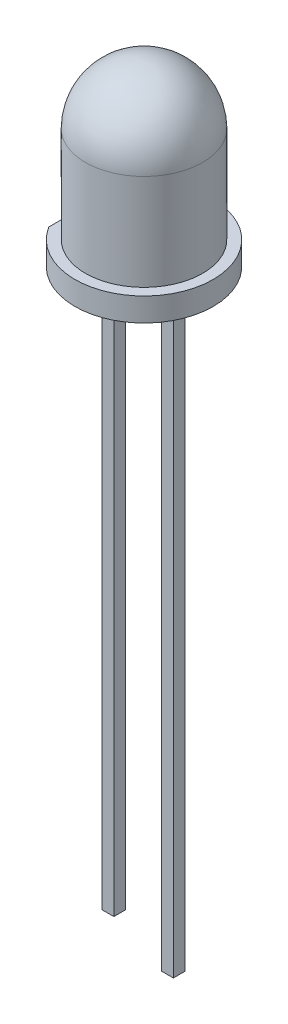
from build123d import *

# Parameters (mm, degrees)
CROQUIS3_W              = 0.5
CROQUIS3_H              = 0.5
SALIENTE_EXTRUIR3_DEPTH = 25.4
CROQUIS4_W              = 0.912534335
CROQUIS4_H              = 5.586103973
CORTAR_EXTRUIR1_DEPTH   = 25.4
CORTAR_EXTRUIR2_REACH   = 946.999
CROQUIS5_W              = 0.5
CROQUIS5_H              = 1


with BuildPart() as part:
    # Croquis2 → Revolución1 (revolve)
    with BuildSketch(Plane(origin=(0, 0, 0), x_dir=(0, 0, -1), z_dir=(1, 0, 0))):
        with BuildLine():
            Line((0, -919.589259582), (2.95, -919.589259582))
            Line((2.95, -919.589259582), (2.95, -918.589259582))
            Line((2.95, -918.589259582), (2.5, -918.589259582))
            Line((2.5, -918.589259582), (2.5, -914.489259582))
            ThreePointArc((2.5, -914.489259582), (1.767766953, -912.721492629), (0, -911.989259582))
            Line((0, -911.989259582), (0, -919.589259582))
        make_face()
    revolve(axis=Axis((0, -1491.471633976, 0), (0, 1, 0)))

    # Croquis3 → Saliente-Extruir3 (add)
    with BuildSketch(Plane.XZ.offset(919.589259582)):
        with Locations((1.27, 0.018814001)):
            Rectangle(CROQUIS3_W, CROQUIS3_H)
        with Locations((-1.27, 0.018814001)):
            Rectangle(CROQUIS3_W, CROQUIS3_H)
    extrude(amount=SALIENTE_EXTRUIR3_DEPTH)

    # Croquis4 → Cortar-Extruir1 (cut)
    with BuildSketch(Plane(origin=(0, -918.589259582, 0), x_dir=(1, 0, 0), z_dir=(0, 1, 0))):
        with Locations((-2.956267168, 0.283432647)):
            Rectangle(CROQUIS4_W, CROQUIS4_H)
    extrude(amount=-CORTAR_EXTRUIR1_DEPTH, mode=Mode.SUBTRACT)

    # Croquis5 → Cortar-Extruir2 (cut, up to next)
    with BuildSketch(Plane.XY.offset(0.268814001), mode=Mode.PRIVATE) as cortar_extruir2_sk1:
        with Locations((-1.27, -944.489259582)):
            Rectangle(CROQUIS5_W, CROQUIS5_H)
    cortar_extruir2_tool1 = extrude(cortar_extruir2_sk1.sketch, amount=-CORTAR_EXTRUIR2_REACH, mode=Mode.PRIVATE) & part.part
    add(cortar_extruir2_tool1.solids().sort_by_distance((-1.27, -944.48926, 0.268814))[0], mode=Mode.SUBTRACT)


solid = part.part
